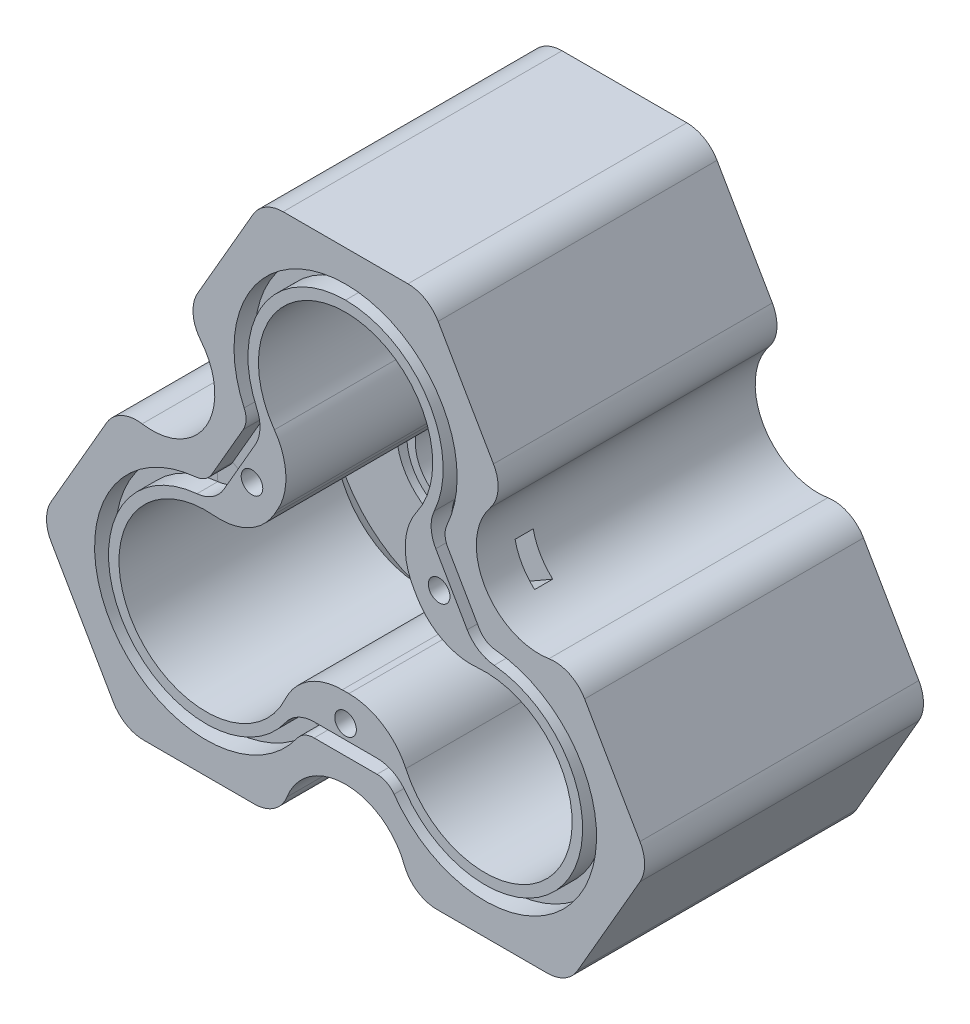
from build123d import *

# Parameters (mm, degrees)
EXTRUDE_1_DEPTH          = 36
CUT_EXTRUDE_START        = 4
CUT_EXTRUDE_1_DEPTH      = 32
SKETCH_2_3_R             = 12.5
CUT_EXTRUDE_2_DEPTH      = 32
PATTERN_CIRCULAR_1_COUNT = 3
EXTRUDE_START            = -4
EXTRUDE_2_DEPTH          = 4
FILLET_1_R               = 5
SKETCH_7_W               = 2
SKETCH_7_H               = 6
SKETCH_8_R               = 1.55
CUT_EXTRUDE_4_DEPTH      = 8
CUT_EXTRUDE_START_2      = -1
SKETCH_11_W              = 5.6
SKETCH_11_H              = 2.6
CUT_EXTRUDE_5_DEPTH      = 79.193153111
SKETCH_12_R              = 5
CUT_EXTRUDE_7_DEPTH      = 1.5
SKETCH_13_R              = 6
CUT_EXTRUDE_8_DEPTH      = 3
PATTERN_CIRCULAR_3_COUNT = 3
SKETCH_14_R              = 8.7
SKETCH_14_R_2            = 7.2
CUT_EXTRUDE_9_DEPTH      = 2
PATTERN_CIRCULAR_4_COUNT = 3
PATTERN_CIRCULAR_5_COUNT = 3


with BuildPart() as part:
    # 草图3 → 凸台-拉伸1 (new body)
    with BuildSketch(Plane.XY):
        with BuildLine():
            Line((11.835680518, 43.594010768), (-11.835680518, 43.594010768))
            Line((-11.835680518, 43.594010768), (-23.253520778, 23.817731326))
            ThreePointArc((-23.253520778, 23.817731326), (-19.959292144, 20.523502692), (-18.753520778, 16.023502692))
            ThreePointArc((-18.753520778, 16.023502692), (-23.253520778, 8.229274058), (-32.253520778, 8.229274058))
            Line((-32.253520778, 8.229274058), (-43.671361037, -11.547005384))
            Line((-43.671361037, -11.547005384), (-31.835680518, -32.047005384))
            Line((-31.835680518, -32.047005384), (-9, -32.047005384))
            ThreePointArc((-9, -32.047005384), (0, -23.047005384), (9, -32.047005384))
            Line((9, -32.047005384), (31.835680518, -32.047005384))
            Line((31.835680518, -32.047005384), (43.671361037, -11.547005384))
            Line((43.671361037, -11.547005384), (32.253520778, 8.229274058))
            ThreePointArc((32.253520778, 8.229274058), (19.959292144, 11.523502692), (23.253520778, 23.817731326))
            Line((23.253520778, 23.817731326), (11.835680518, 43.594010768))
        make_face()
    extrude(amount=EXTRUDE_1_DEPTH)

    # 草图2 → 切除-拉伸1 (cut)
    with BuildSketch(Plane.XY.offset(CUT_EXTRUDE_START)):
        with BuildLine():
            ThreePointArc((-10.207581819, 15.879076713), (-8.566497102, 11.096786669), (-9.762812095, 6.184324194))
            Line((-9.762812095, 6.184324194), (-10.237187905, 5.362681189))
            ThreePointArc((-10.237187905, 5.362681189), (-13.893347706, 1.870410777), (-18.855474732, 0.90048681))
            ThreePointArc((-18.855474732, 0.90048681), (-9.174682453, -5.297005384), (-8.647892913, -16.779563523))
            ThreePointArc((-8.647892913, -16.779563523), (-5.326850604, -12.967197446), (-0.47437581, -11.547005384))
            Line((-0.47437581, -11.547005384), (0.47437581, -11.547005384))
            ThreePointArc((0.47437581, -11.547005384), (5.326850604, -12.967197446), (8.647892913, -16.779563523))
            ThreePointArc((8.647892913, -16.779563523), (9.174682453, -5.297005384), (18.855474732, 0.90048681))
            ThreePointArc((18.855474732, 0.90048681), (13.893347706, 1.870410777), (10.237187905, 5.362681189))
            Line((10.237187905, 5.362681189), (9.762812095, 6.184324194))
            ThreePointArc((9.762812095, 6.184324194), (8.566497102, 11.096786669), (10.207581819, 15.879076713))
            ThreePointArc((10.207581819, 15.879076713), (0, 10.594010768), (-10.207581819, 15.879076713))
        make_face()
    extrude(amount=CUT_EXTRUDE_1_DEPTH, mode=Mode.SUBTRACT)

    # 草图2<3> → 切除-拉伸2 (cut)
    with BuildSketch(Plane.XY.offset(CUT_EXTRUDE_START)):
        with Locations((0, 23.094010768)):
            Circle(SKETCH_2_3_R)
        with Locations((-20, -11.547005384)):
            Circle(SKETCH_2_3_R)
        with Locations((20, -11.547005384)):
            Circle(SKETCH_2_3_R)
    extrude(amount=CUT_EXTRUDE_2_DEPTH, mode=Mode.SUBTRACT)

    # 草图4 → 切除-旋转1 (revolve, cut)
    with BuildSketch(Plane(origin=(0, 0, 0), x_dir=(0, 0, -1), z_dir=(1, 0, 0))):
        with BuildLine():
            Line((-5, 23.094010768), (0, 23.094010768))
            Line((0, 23.094010768), (0, 41.594010768))
            ThreePointArc((0, 41.594010768), (-2.897363718, 38.9251472), (-5, 35.594010768))
            Line((-5, 35.594010768), (-5, 23.094010768))
        make_face()
    cut_revolve_1 = revolve(axis=Axis((0, 23.094010768, 0), (0, 0, 1)), mode=Mode.SUBTRACT)

    # 阵列(圆周)1: 切除-旋转1 ×3 about axis
    pattern_circular_1_axis = Axis((0, 0, 0), (0, 0, 1))
    for i in range(1, PATTERN_CIRCULAR_1_COUNT):
        add(cut_revolve_1.rotate(pattern_circular_1_axis, i * 360 / PATTERN_CIRCULAR_1_COUNT), mode=Mode.SUBTRACT)

    # 草图3<3> → 凸台-拉伸2 (add)
    with BuildSketch(Plane.XY.offset(EXTRUDE_START)):
        with BuildLine():
            Line((11.835680518, 43.594010768), (-11.835680518, 43.594010768))
            Line((-11.835680518, 43.594010768), (-23.253520778, 23.817731326))
            ThreePointArc((-23.253520778, 23.817731326), (-19.959292144, 20.523502692), (-18.753520778, 16.023502692))
            ThreePointArc((-18.753520778, 16.023502692), (-23.253520778, 8.229274058), (-32.253520778, 8.229274058))
            Line((-32.253520778, 8.229274058), (-43.671361037, -11.547005384))
            Line((-43.671361037, -11.547005384), (-31.835680518, -32.047005384))
            Line((-31.835680518, -32.047005384), (-9, -32.047005384))
            ThreePointArc((-9, -32.047005384), (0, -23.047005384), (9, -32.047005384))
            Line((9, -32.047005384), (31.835680518, -32.047005384))
            Line((31.835680518, -32.047005384), (43.671361037, -11.547005384))
            Line((43.671361037, -11.547005384), (32.253520778, 8.229274058))
            ThreePointArc((32.253520778, 8.229274058), (19.959292144, 11.523502692), (23.253520778, 23.817731326))
            Line((23.253520778, 23.817731326), (11.835680518, 43.594010768))
        make_face()
    extrude(amount=EXTRUDE_2_DEPTH)

    # 圆角1
    fillet_1_edges = [part.edges().sort_by_distance(p)[0] for p in [
        (32.253520778, 8.229274058, 16),
        (43.671361037, -11.547005384, 16),
        (31.835680518, -32.047005384, 16),
        (9, -32.047005384, 16),
        (-9, -32.047005384, 16),
        (-31.835680518, -32.047005384, 16),
        (-43.671361037, -11.547005384, 16),
        (-32.253520778, 8.229274058, 16),
        (-23.253520778, 23.817731326, 16),
        (-11.835680518, 43.594010768, 16),
        (11.835680518, 43.594010768, 16),
        (23.253520778, 23.817731326, 16),
    ]]
    fillet(fillet_1_edges, radius=FILLET_1_R)

    # 切除-扫描1: sweep along a path in 草图6
    with BuildLine(Plane.XY.offset(36)) as sweep_1_path:
        Line((-13.808144519, 13.177602903), (-18.316211134, 5.369402481))
        ThreePointArc((-18.316211134, 5.369402481), (-19.620040628, 4.002917019), (-21.405510065, 3.387000825))
        ThreePointArc((-21.405510065, 3.387000825), (-32.990381057, -19.047005384), (-7.769526275, -20.23121591))
        ThreePointArc((-7.769526275, -20.23121591), (-6.343392486, -18.992912117), (-4.508066615, -18.547005384))
        Line((-4.508066615, -18.547005384), (4.508066615, -18.547005384))
        ThreePointArc((4.508066615, -18.547005384), (6.343392486, -18.992912117), (7.769526275, -20.23121591))
        ThreePointArc((7.769526275, -20.23121591), (32.990381057, -19.047005384), (21.405510065, 3.387000825))
        ThreePointArc((21.405510065, 3.387000825), (19.620040628, 4.002917019), (18.316211134, 5.369402481))
        Line((18.316211134, 5.369402481), (13.808144519, 13.177602903))
        ThreePointArc((13.808144519, 13.177602903), (13.276648142, 14.989995098), (13.63598379, 16.844215085))
        ThreePointArc((13.63598379, 16.844215085), (0, 38.094010768), (-13.63598379, 16.844215085))
        ThreePointArc((-13.63598379, 16.844215085), (-13.276648142, 14.989995098), (-13.808144519, 13.177602903))
    # 草图7 → 切除-扫描1 (sweep, cut)
    with BuildSketch(Plane(origin=(0, 0, 0), x_dir=(0, 1, 0), z_dir=(-1, 0, 0))):
        with Locations((38.094010768, -36)):
            Rectangle(SKETCH_7_W, SKETCH_7_H)
    sweep(path=sweep_1_path.line, mode=Mode.SUBTRACT)

    # 草图8 → 切除-拉伸4 (cut)
    with BuildSketch(Plane.XY.offset(36)):
        with Locations((-13.423393759, 7.75)):
            Circle(SKETCH_8_R)
        with Locations((13.423393759, 7.75)):
            Circle(SKETCH_8_R)
        with Locations((0, -15.5)):
            Circle(SKETCH_8_R)
    extrude(amount=-CUT_EXTRUDE_4_DEPTH, mode=Mode.SUBTRACT)

    # 草图11 → 切除-拉伸5 (cut, through all)
    with BuildSketch(Plane(origin=(0, -12.4, 0), x_dir=(1, 0, 0), z_dir=(0, 1, 0)).offset(CUT_EXTRUDE_START_2)):
        with Locations((0, -29.330246335)):
            Rectangle(SKETCH_11_W, SKETCH_11_H)
    cut_extrude_5 = extrude(amount=-CUT_EXTRUDE_5_DEPTH, mode=Mode.SUBTRACT)

    # 草图12 → 切除-拉伸7 (cut)
    with BuildSketch(Plane.XY.offset(4)):
        Circle(SKETCH_12_R)
    extrude(amount=-CUT_EXTRUDE_7_DEPTH, mode=Mode.SUBTRACT)

    # 草图13 → 切除-拉伸8 (cut)
    with BuildSketch(Plane.XY):
        with Locations((-20, -11.547005384)):
            Circle(SKETCH_13_R)
    cut_extrude_8 = extrude(amount=-CUT_EXTRUDE_8_DEPTH, mode=Mode.SUBTRACT)

    # 阵列(圆周)3: 切除-拉伸8 ×3 about axis
    pattern_circular_3_axis = Axis((0, 0, 2.5), (0, 0, 1))
    for i in range(1, PATTERN_CIRCULAR_3_COUNT):
        add(cut_extrude_8.rotate(pattern_circular_3_axis, i * 360 / PATTERN_CIRCULAR_3_COUNT), mode=Mode.SUBTRACT)

    # 草图14 → 切除-拉伸9 (cut)
    with BuildSketch(Plane.XY):
        with Locations((-20, -11.547005384)):
            Circle(SKETCH_14_R)
        with Locations((-20, -11.547005384)):
            Circle(SKETCH_14_R_2, mode=Mode.SUBTRACT)
    cut_extrude_9 = extrude(amount=-CUT_EXTRUDE_9_DEPTH, mode=Mode.SUBTRACT)

    # 阵列(圆周)4: 切除-拉伸9 ×3 about axis
    pattern_circular_4_axis = Axis((0, 0, 2.5), (0, 0, 1))
    for i in range(1, PATTERN_CIRCULAR_4_COUNT):
        add(cut_extrude_9.rotate(pattern_circular_4_axis, i * 360 / PATTERN_CIRCULAR_4_COUNT), mode=Mode.SUBTRACT)

    # 阵列(圆周)5: 切除-拉伸5 ×3 about axis
    pattern_circular_5_axis = Axis((0, 0, 2.5), (0, 0, 1))
    for i in range(1, PATTERN_CIRCULAR_5_COUNT):
        add(cut_extrude_5.rotate(pattern_circular_5_axis, i * 360 / PATTERN_CIRCULAR_5_COUNT), mode=Mode.SUBTRACT)


solid = part.part
